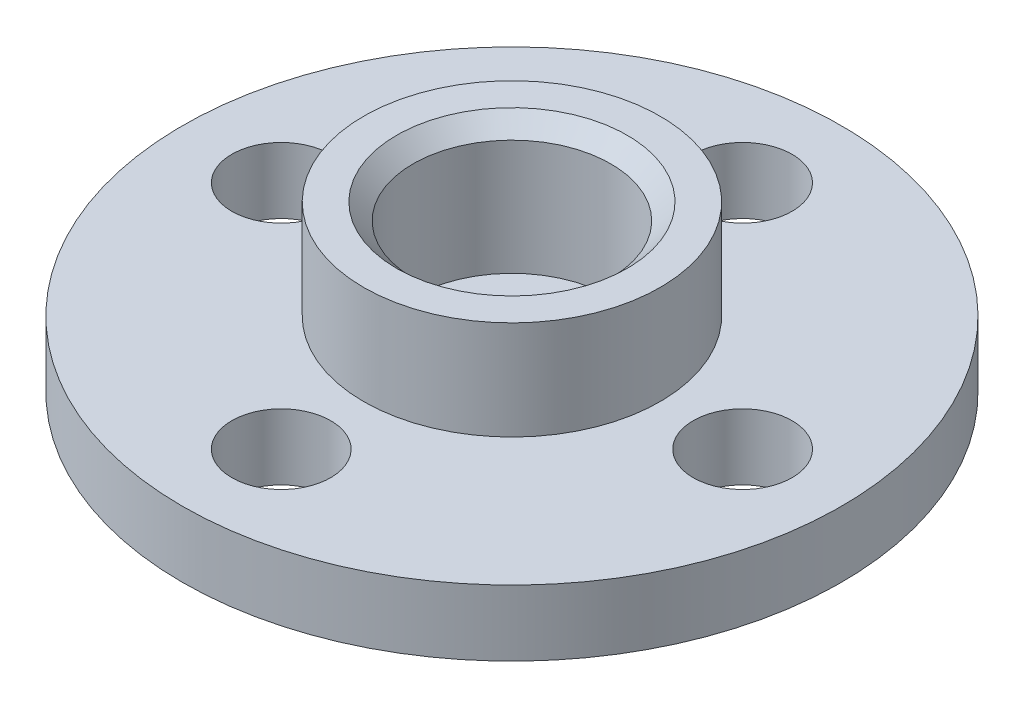
from build123d import *

# Parameters (mm, degrees)
SKETCH_1_R          = 10
EXTRUDE_1_DEPTH     = 2
SKETCH_2_R          = 4.5
EXTRUDE_2_DEPTH     = 3
SKETCH_3_R          = 1.5
CUT_EXTRUDE_1_DEPTH = 3
SKETCH_4_R          = 3
CUT_EXTRUDE_2_DEPTH = 4
SKETCH_5_R          = 1.5
CUT_EXTRUDE_3_DEPTH = 4
CHAMFER_2_SIZE      = 0.5


with BuildPart() as part:
    # 草图1 → 凸台-拉伸1 (new body)
    with BuildSketch(Plane(origin=(0, 0, 0), x_dir=(1, 0, 0), z_dir=(0, 1, 0))):
        with Locations(Location((0, 0, 0), (0, 0, 270))):
            Circle(SKETCH_1_R)
    extrude(amount=EXTRUDE_1_DEPTH)

    # 草图2 → 凸台-拉伸2 (add)
    with BuildSketch(Plane(origin=(0, 2, 0), x_dir=(1, 0, 0), z_dir=(0, 1, 0))):
        with Locations(Location((0, 0, 0), (0, 0, 270))):
            Circle(SKETCH_2_R)
    extrude(amount=EXTRUDE_2_DEPTH)

    # 草图3 → 切除-拉伸1 (cut)
    with BuildSketch(Plane(origin=(0, 2, 0), x_dir=(1, 0, 0), z_dir=(0, 1, 0))):
        with Locations(Location((-7, 0, 0), (0, 0, 270))):
            Circle(SKETCH_3_R)
        with Locations(Location((0, 7, 0), (0, 0, 270))):
            Circle(SKETCH_3_R)
        with Locations(Location((7, 0, 0), (0, 0, 270))):
            Circle(SKETCH_3_R)
        with Locations(Location((0, -7, 0), (0, 0, 270))):
            Circle(SKETCH_3_R)
    extrude(amount=-CUT_EXTRUDE_1_DEPTH, mode=Mode.SUBTRACT)

    # 草图4 → 切除-拉伸2 (cut)
    with BuildSketch(Plane(origin=(0, 5, 0), x_dir=(1, 0, 0), z_dir=(0, 1, 0))):
        with Locations(Location((0, 0, 0), (0, 0, 270))):
            Circle(SKETCH_4_R)
    extrude(amount=-CUT_EXTRUDE_2_DEPTH, mode=Mode.SUBTRACT)

    # 草图5 → 切除-拉伸3 (cut)
    with BuildSketch(Plane(origin=(0, 1, 0), x_dir=(1, 0, 0), z_dir=(0, 1, 0))):
        with Locations(Location((0, 0, 0), (0, 0, 270))):
            Circle(SKETCH_5_R)
    extrude(amount=-CUT_EXTRUDE_3_DEPTH, mode=Mode.SUBTRACT)

    # 倒角2
    chamfer_2_edges = [part.edges().sort_by_distance(p)[0] for p in [
        (0, 5, -3),
    ]]
    chamfer(chamfer_2_edges, length=CHAMFER_2_SIZE)


solid = part.part
